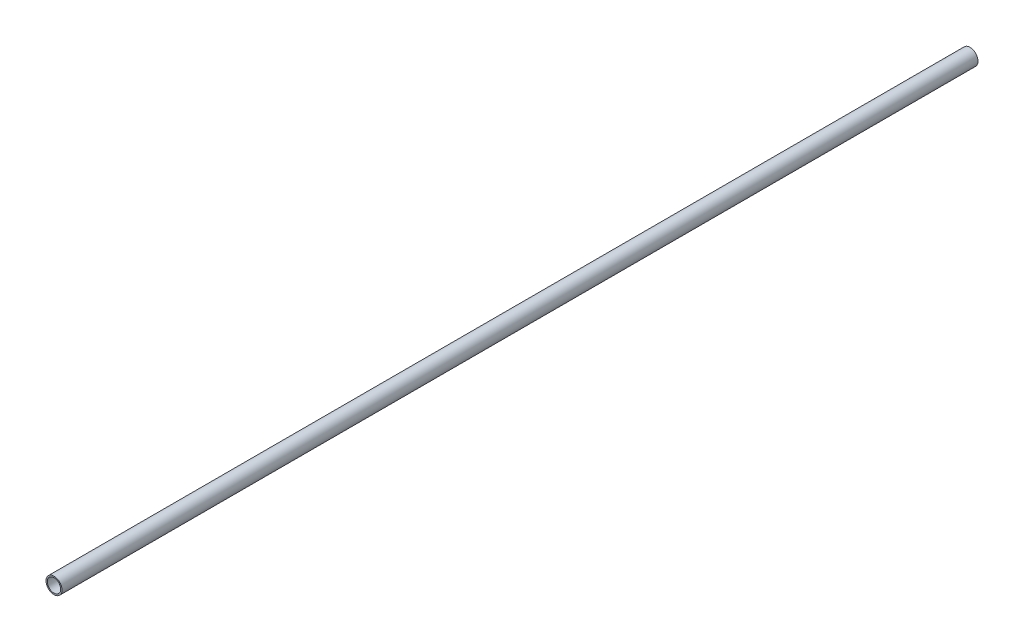
from build123d import *

# Parameters (mm, degrees)
SKETCH_1_R      = 6
SKETCH_1_R_2    = 5
EXTRUDE_1_DEPTH = 685


with BuildPart() as part:
    # 草图1 → 拉伸-薄壁1 (new body)
    with BuildSketch(Plane.XY):
        Circle(SKETCH_1_R)
        Circle(SKETCH_1_R_2, mode=Mode.SUBTRACT)
    extrude(amount=EXTRUDE_1_DEPTH)


solid = part.part
